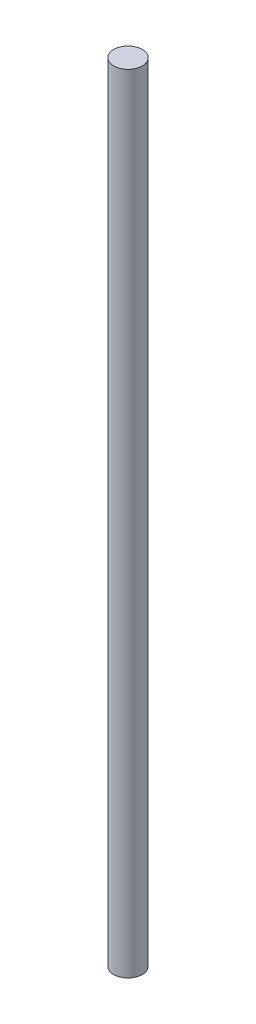
from build123d import *

# Parameters (mm, degrees)
ESBO_O1_R                = 4
RESSALTO_EXTRUS_O1_DEPTH = 220


with BuildPart() as part:
    # Esboço1 → Ressalto-extrusão1 (new body)
    with BuildSketch(Plane(origin=(0, 0, 0), x_dir=(1, 0, 0), z_dir=(0, 1, 0))):
        with Locations(Location((0, 0, 0), (0, 0, 270))):
            Circle(ESBO_O1_R)
    extrude(amount=RESSALTO_EXTRUS_O1_DEPTH)


solid = part.part
